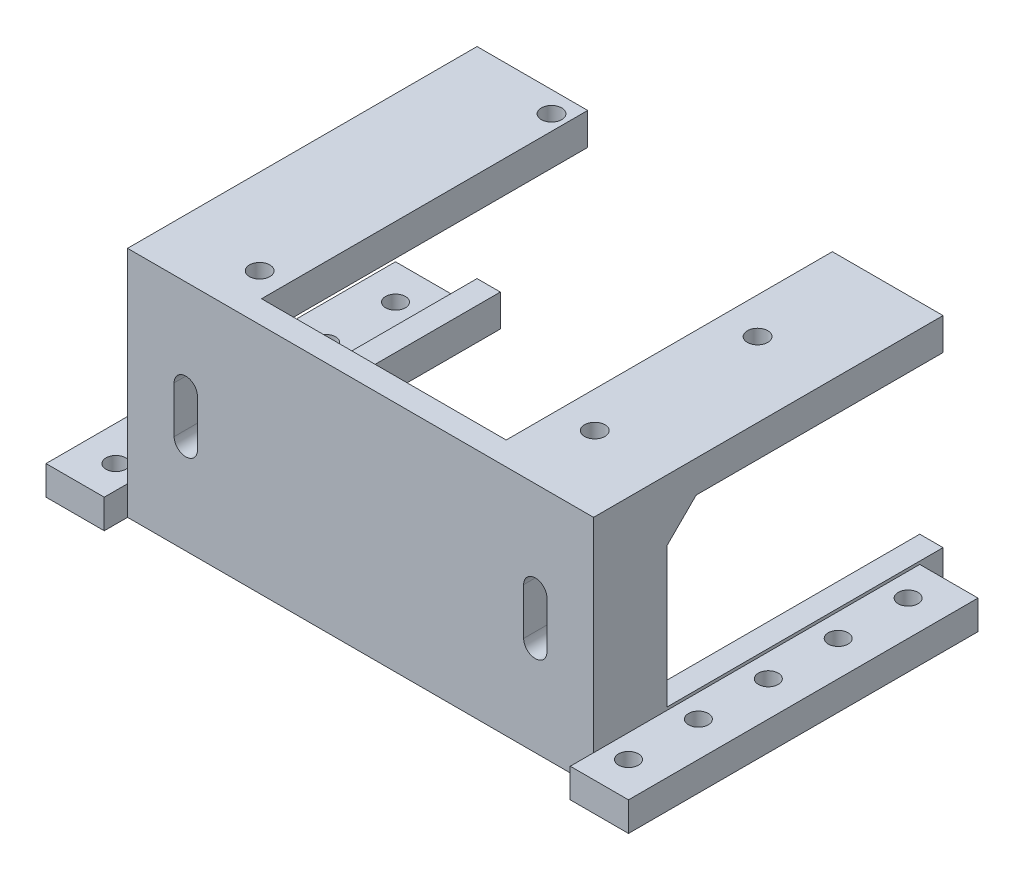
from build123d import *

# Parameters (mm, degrees)
SKETCH_1_W          = 80
SKETCH_1_H          = 60
EXTRUDE_1_DEPTH     = 20
SKETCH_2_W          = 72
SKETCH_2_H          = 56
CUT_EXTRUDE_1_DEPTH = 70
SKETCH_3_W          = 47.385697094
SKETCH_3_H          = 29
CUT_EXTRUDE_2_DEPTH = 80
SKETCH_4_W          = 10
SKETCH_4_H          = 60
EXTRUDE_2_DEPTH     = 5
SKETCH_5_R          = 1.7
CUT_EXTRUDE_3_DEPTH = 25
SKETCH_6_W          = 15
SKETCH_6_H          = 56
EXTRUDE_3_DEPTH     = 5.5
SKETCH_8_R          = 1.75
CUT_EXTRUDE_5_DEPTH = 10
CHAMFER_1_SIZE      = 5
CUT_EXTRUDE_8_DEPTH = 10


with BuildPart() as part:
    # 草图1 → 凸台-拉伸1 (new, symmetric)
    with BuildSketch(Plane(origin=(0, 0, 0), x_dir=(1, 0, 0), z_dir=(0, 1, 0))):
        Rectangle(SKETCH_1_W, SKETCH_1_H)
    extrude(amount=EXTRUDE_1_DEPTH, both=True)

    # 草图2 → 切除-拉伸1 (cut)
    with BuildSketch(Plane(origin=(0, 20, 0), x_dir=(1, 0, 0), z_dir=(0, 1, 0))):
        with Locations((0, 2)):
            Rectangle(SKETCH_2_W, SKETCH_2_H)
    extrude(amount=-CUT_EXTRUDE_1_DEPTH, mode=Mode.SUBTRACT)

    # 草图3 → 切除-拉伸2 (cut)
    with BuildSketch(Plane(origin=(40, 0, 0), x_dir=(0, 0, -1), z_dir=(1, 0, 0))):
        with Locations((6.307151453, 0)):
            Rectangle(SKETCH_3_W, SKETCH_3_H)
    extrude(amount=-CUT_EXTRUDE_2_DEPTH, mode=Mode.SUBTRACT)

    # 草图4 → 凸台-拉伸2 (add)
    with BuildSketch(Plane.XZ.offset(20)):
        with Locations((-45, 4)):
            Rectangle(SKETCH_4_W, SKETCH_4_H)
        with Locations((45, 4)):
            Rectangle(SKETCH_4_W, SKETCH_4_H)
    extrude(amount=-EXTRUDE_2_DEPTH)

    # 草图5 → 切除-拉伸3 (cut)
    with BuildSketch(Plane(origin=(0, -15, 0), x_dir=(1, 0, 0), z_dir=(0, 1, 0))):
        with Locations(Location((-44, 20, 0), (0, 0, 270))):
            Circle(SKETCH_5_R)
        with Locations(Location((-44, 8, 0), (0, 0, 270))):
            Circle(SKETCH_5_R)
        with Locations(Location((-44, -4, 0), (0, 0, 270))):
            Circle(SKETCH_5_R)
        with Locations(Location((-44, -16, 0), (0, 0, 270))):
            Circle(SKETCH_5_R)
        with Locations(Location((-44, -28, 0), (0, 0, 270))):
            Circle(SKETCH_5_R)
        with Locations(Location((44, -28, 0), (0, 0, 90))):
            Circle(SKETCH_5_R)
        with Locations(Location((44, -16, 0), (0, 0, 90))):
            Circle(SKETCH_5_R)
        with Locations(Location((44, -4, 0), (0, 0, 90))):
            Circle(SKETCH_5_R)
        with Locations(Location((44, 8, 0), (0, 0, 90))):
            Circle(SKETCH_5_R)
        with Locations(Location((44, 20, 0), (0, 0, 90))):
            Circle(SKETCH_5_R)
    extrude(amount=-CUT_EXTRUDE_3_DEPTH, mode=Mode.SUBTRACT)

    # 草图6 → 凸台-拉伸3 (add)
    with BuildSketch(Plane(origin=(0, 20, 0), x_dir=(1, 0, 0), z_dir=(0, 1, 0))):
        with Locations((-28.5, 2)):
            Rectangle(SKETCH_6_W, SKETCH_6_H)
        with Locations((28.5, 2)):
            Rectangle(SKETCH_6_W, SKETCH_6_H)
    extrude(amount=-EXTRUDE_3_DEPTH)

    # 草图8 → 切除-拉伸5 (cut)
    with BuildSketch(Plane(origin=(0, 20, 0), x_dir=(1, 0, 0), z_dir=(0, 1, 0))):
        with Locations(Location((-25.32, -22, 0), (0, 0, 270))):
            Circle(SKETCH_8_R)
        with Locations(Location((-23.61, 26.395, 0), (0, 0, 270))):
            Circle(SKETCH_8_R)
        with Locations(Location((27.2, 10.96, 0), (0, 0, 270))):
            Circle(SKETCH_8_R)
        with Locations(Location((27.2, -17, 0), (0, 0, 270))):
            Circle(SKETCH_8_R)
    extrude(amount=-CUT_EXTRUDE_5_DEPTH, mode=Mode.SUBTRACT)

    # 倒角1
    chamfer_1_edges = [part.edges().sort_by_distance(p)[0] for p in [
        (38, 14.5, 17.385697094),
        (-38, 14.5, 17.385697094),
    ]]
    chamfer(chamfer_1_edges, length=CHAMFER_1_SIZE)

    # 草图10 → 切除-拉伸8 (cut)
    with BuildSketch(Plane.XY.offset(30)):
        with BuildLine():
            Line((-28, 4), (-28, -4))
            ThreePointArc((-28, -4), (-30, -6), (-32, -4))
            Line((-32, -4), (-32, 4))
            ThreePointArc((-32, 4), (-30, 6), (-28, 4))
        make_face()
        with BuildLine():
            Line((28, 4), (28, -4))
            ThreePointArc((28, -4), (30, -6), (32, -4))
            Line((32, -4), (32, 4))
            ThreePointArc((32, 4), (30, 6), (28, 4))
        make_face()
    extrude(amount=-CUT_EXTRUDE_8_DEPTH, mode=Mode.SUBTRACT)


solid = part.part
